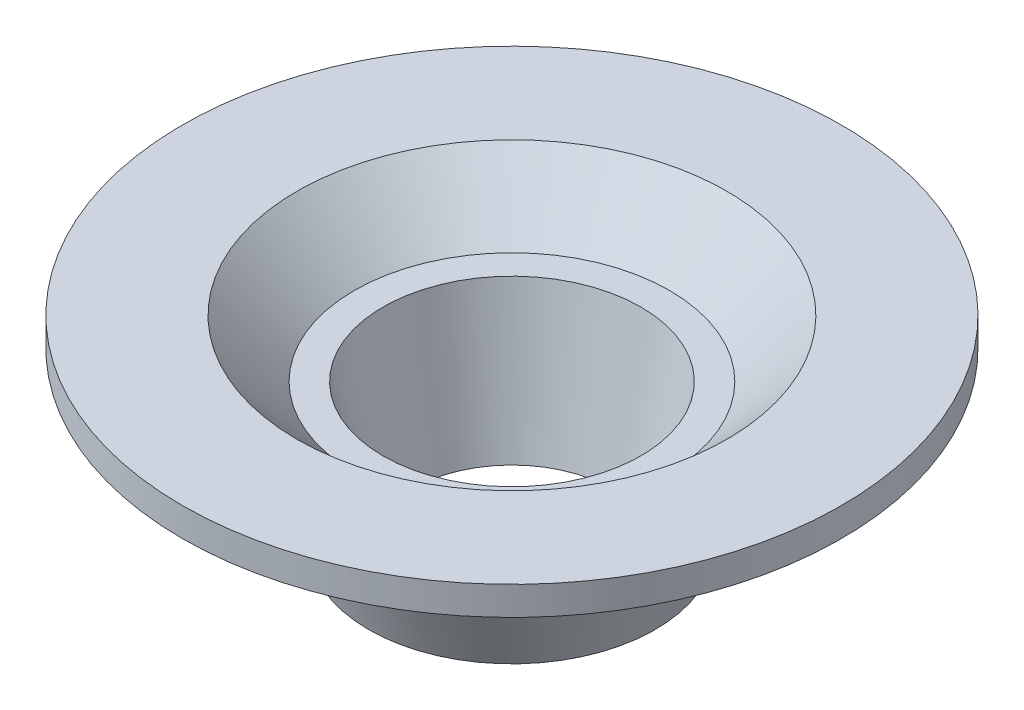
from build123d import *


with BuildPart() as part:
    # Sketch1 → Revolve1 (revolve)
    with BuildSketch(Plane(origin=(0, 0, 0), x_dir=(0, 0, -1), z_dir=(1, 0, 0)), mode=Mode.PRIVATE) as revolve1_sk:
        Polygon((3.5, -5), (4.5, 0), (5.5, 0), (7.5, 2), (11.5, 2), (11.5, 1), (9.5, 1), (7.5, -1), (6.5, -1), (5, -5), align=None)
    revolve(revolve1_sk.sketch.rotate(Axis((0, 0, 0), (0, -1, 0)), 180), axis=Axis((0, 0, 0), (0, -1, 0)))


solid = part.part
